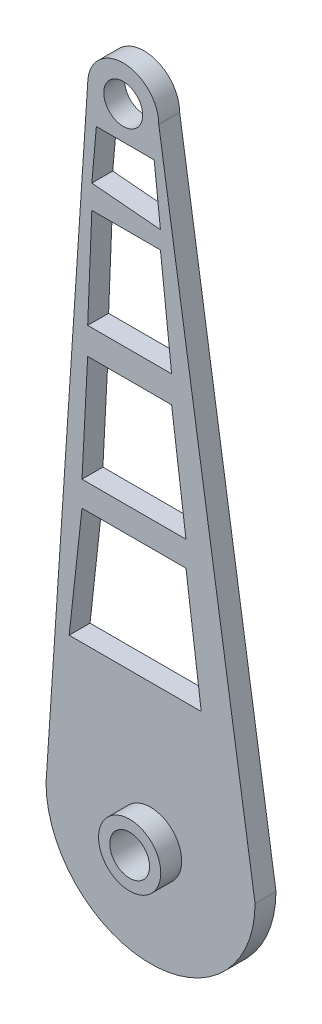
from build123d import *

# Parameters (mm, degrees)
SKETCH2_R           = 4.766632538
SKETCH2_R_2         = 4.65778258
BOSS_EXTRUDE1_DEPTH = 5
SKETCH3_R           = 7.443841037
SKETCH3_R_2         = 4.766632538
BOSS_EXTRUDE2_DEPTH = 5


with BuildPart() as part:
    # Sketch2 → Boss-Extrude1 (new body)
    with BuildSketch(Plane.XY):
        with BuildLine():
            Line((-15.037844772, 149.857454221), (-25, 0))
            ThreePointArc((-25, 0), (0, -25), (25, 0))
            Line((25, 0), (1.962155228, 149.857454221))
            ThreePointArc((1.962155228, 149.857454221), (-6.537844772, 158.357454221), (-15.037844772, 149.857454221))
        make_face()
        Circle(SKETCH2_R, mode=Mode.SUBTRACT)
        with Locations((-6.537844772, 149.857454221)):
            Circle(SKETCH2_R_2, mode=Mode.SUBTRACT)
        Polygon((-19.47250371, 33.326803339), (-16.399054011, 61.179494137), (8.4679481, 61.179494137), (12.123565561, 33.326803339), align=None, mode=Mode.SUBTRACT)
        Polygon((-16.399054011, 67.186691276), (-15.037844772, 93.311013718), (5.039175994, 93.311013718), (8.4679481, 67.186691276), align=None, mode=Mode.SUBTRACT)
        Polygon((-15.037844772, 99.732600208), (-14.044403658, 124.0583194), (2.367565215, 124.0583194), (5.039175994, 99.732600208), align=None, mode=Mode.SUBTRACT)
        Polygon((-12.962496523, 141.96989308), (-14.044403658, 129.708278883), (2.367565215, 128.260163982), (0.861872424, 141.96989308), align=None, mode=Mode.SUBTRACT)
    extrude(amount=BOSS_EXTRUDE1_DEPTH)

    # Sketch3 → Boss-Extrude2 (add)
    with BuildSketch(Plane.XY.offset(5)):
        Circle(SKETCH3_R)
        Circle(SKETCH3_R_2, mode=Mode.SUBTRACT)
    extrude(amount=BOSS_EXTRUDE2_DEPTH)


solid = part.part
